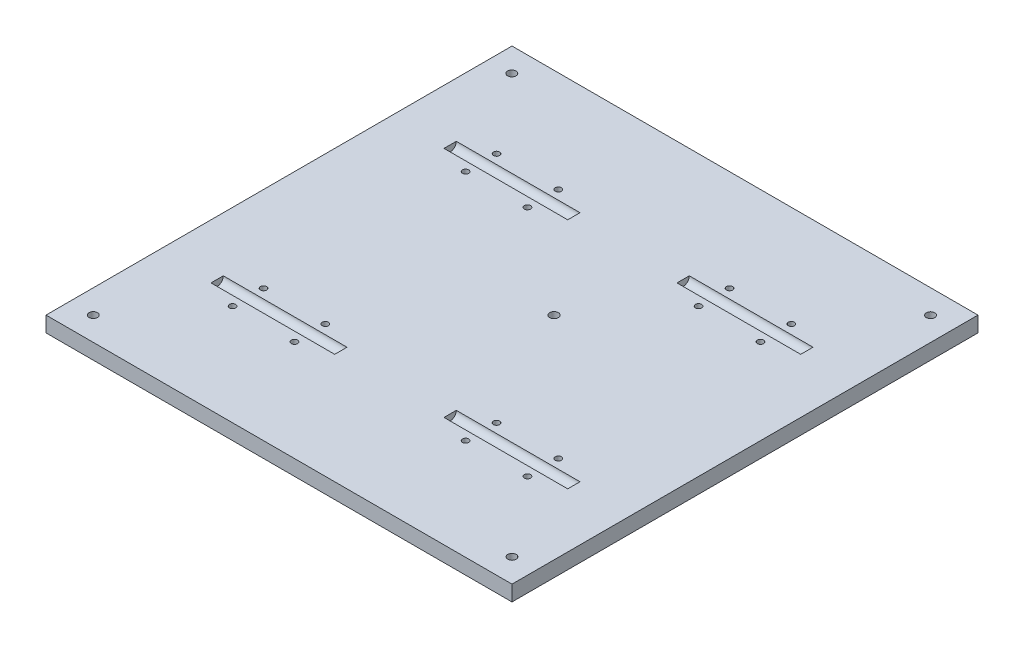
from build123d import *

# Parameters (mm, degrees)
SKETCH1_W               = 452
SKETCH1_H               = 452
BOSS_EXTRUDE1_DEPTH     = 15
SKETCH15_R              = 5.975
CUT_EXTRUDE12_DEPTH     = 120
MIRROR2_COPY_1_SKETCH_R = 5.975
MIRROR2_COPY_1_DEPTH    = 120
SKETCH16_R              = 3
CUT_EXTRUDE13_DEPTH     = 120
SKETCH17_R              = 4.1
SKETCH17_R_2            = 4.25
CUT_EXTRUDE14_DEPTH     = 120
MIRROR4_COPY_1_SKETCH_R = 3
MIRROR4_COPY_1_DEPTH    = 120


with BuildPart() as part:
    # Sketch1 → Boss-Extrude1 (new body)
    with BuildSketch(Plane.XZ.offset(0.5)):
        with Locations((-424, -424)):
            Rectangle(SKETCH1_W, SKETCH1_H)
    extrude(amount=-BOSS_EXTRUDE1_DEPTH)

    # Sketch15 → Cut-Extrude12 (cut)
    with BuildSketch(Plane(origin=(-477, 324.820623632, -300), x_dir=(0, 0, 1), z_dir=(1, 0, 0))):
        with Locations((-11, 310.320623632)):
            Circle(SKETCH15_R)
    cut_extrude12 = extrude(amount=-CUT_EXTRUDE12_DEPTH, mode=Mode.SUBTRACT)

    # Mirror1: Cut-Extrude12 across plane
    add(cut_extrude12.mirror(Plane(origin=(0, 0, -424), x_dir=(1, 0, 0), z_dir=(0, 0, -1))), mode=Mode.SUBTRACT)

    # Mirror2: Cut-Extrude12 across plane
    add(cut_extrude12.mirror(Plane.ZY.offset(424)), mode=Mode.SUBTRACT)

    # Mirror2 copy 1 sketch → Mirror2 copy 1 (cut)
    with BuildSketch(Plane(origin=(-371, 324.820623632, -548), x_dir=(0, 0, -1), z_dir=(-1, 0, 0))):
        with Locations((-11, 310.320623632)):
            Circle(MIRROR2_COPY_1_SKETCH_R)
    extrude(amount=-MIRROR2_COPY_1_DEPTH, mode=Mode.SUBTRACT)

    # Sketch16 → Cut-Extrude13 (cut)
    with BuildSketch(Plane(origin=(-300, 101.5, -300), x_dir=(-1, 0, 0), z_dir=(0, 1, 0))):
        with Locations(Location((-19, -26, 0), (0, 0, 270))):
            Circle(SKETCH16_R)
        with Locations(Location((41, -26, 0), (0, 0, 270))):
            Circle(SKETCH16_R)
        with Locations(Location((41, 4, 0), (0, 0, 270))):
            Circle(SKETCH16_R)
        with Locations(Location((-19, 4, 0), (0, 0, 270))):
            Circle(SKETCH16_R)
    cut_extrude13 = extrude(amount=-CUT_EXTRUDE13_DEPTH, mode=Mode.SUBTRACT)

    # Sketch17 → Cut-Extrude14 (cut)
    with BuildSketch(Plane(origin=(-300, 101.5, -300), x_dir=(-1, 0, 0), z_dir=(0, 1, 0))):
        with Locations(Location((327.071067812, -326.871067812, 0), (0, 0, 270))):
            Circle(SKETCH17_R)
        with Locations(Location((-79.071067812, -326.871067812, 0), (0, 0, 270))):
            Circle(SKETCH17_R)
        with Locations(Location((103.571067812, -144.328932188, 0), (0, 0, 270))):
            Circle(SKETCH17_R_2)
        with Locations(Location((327.071067812, 79.071067812, 0), (0, 0, 270))):
            Circle(SKETCH17_R)
        with Locations(Location((-79.071067812, 79.071067812, 0), (0, 0, 270))):
            Circle(SKETCH17_R)
    extrude(amount=-CUT_EXTRUDE14_DEPTH, mode=Mode.SUBTRACT)

    # Mirror3: Cut-Extrude13 across plane
    add(cut_extrude13.mirror(Plane.ZY.offset(424)), mode=Mode.SUBTRACT)

    # Mirror4: Cut-Extrude13 across plane
    add(cut_extrude13.mirror(Plane(origin=(0, 0, -424), x_dir=(1, 0, 0), z_dir=(0, 0, -1))), mode=Mode.SUBTRACT)

    # Mirror4 copy 1 sketch → Mirror4 copy 1 (cut)
    with BuildSketch(Plane(origin=(-548, 101.5, -548), x_dir=(1, 0, 0), z_dir=(0, 1, 0))):
        with Locations(Location((-19, -26, 0), (0, 0, 270))):
            Circle(MIRROR4_COPY_1_SKETCH_R)
        with Locations(Location((41, -26, 0), (0, 0, 270))):
            Circle(MIRROR4_COPY_1_SKETCH_R)
        with Locations(Location((41, 4, 0), (0, 0, 270))):
            Circle(MIRROR4_COPY_1_SKETCH_R)
        with Locations(Location((-19, 4, 0), (0, 0, 270))):
            Circle(MIRROR4_COPY_1_SKETCH_R)
    extrude(amount=-MIRROR4_COPY_1_DEPTH, mode=Mode.SUBTRACT)


solid = part.part
